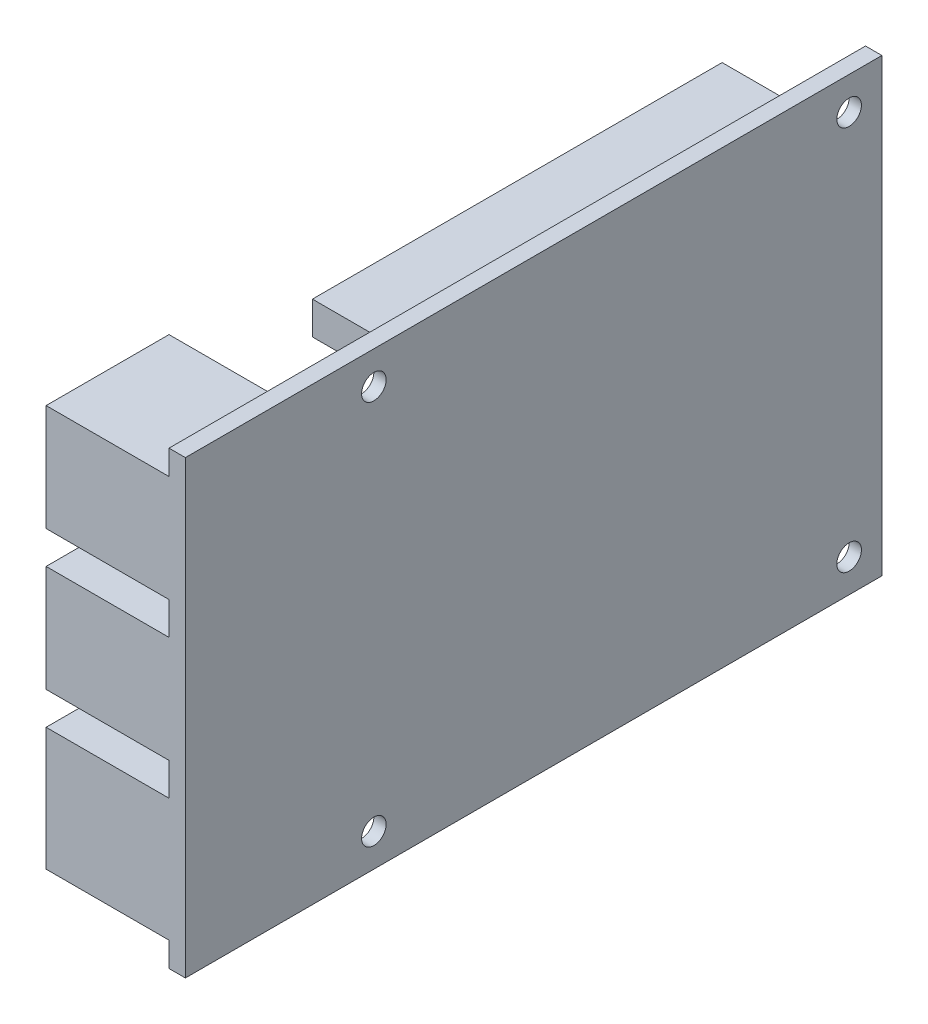
from build123d import *

# Parameters (mm, degrees)
ESQUISSE1_W             = 85
ESQUISSE1_H             = 55
BOSS_EXTRU_1_DEPTH      = 2
ESQUISSE2_W             = 20
ESQUISSE2_H             = 15
ESQUISSE2_W_2           = 15
ESQUISSE2_H_2           = 13
BOSS_EXTRU_2_DEPTH      = 15
ESQUISSE3_R             = 1.5
ENL_V_MAT_EXTRU_1_DEPTH = 15
ESQUISSE5_R             = 2.5
ENL_V_MAT_EXTRU_2_DEPTH = 0.5
ESQUISSE6_W             = 50
ESQUISSE6_H             = 4
BOSS_EXTRU_3_DEPTH      = 9


with BuildPart() as part:
    # Esquisse1 → Boss.-Extru.1 (new body)
    with BuildSketch(Plane(origin=(0, 0, 0), x_dir=(0, 0, -1), z_dir=(1, 0, 0))):
        Rectangle(ESQUISSE1_W, ESQUISSE1_H)
    extrude(amount=BOSS_EXTRU_1_DEPTH)

    # Esquisse2 → Boss.-Extru.2 (add)
    with BuildSketch(Plane.ZY):
        with Locations((32.5, -17)):
            Rectangle(ESQUISSE2_W, ESQUISSE2_H)
        with Locations((35, 1)):
            Rectangle(ESQUISSE2_W_2, ESQUISSE2_H_2)
        with Locations((35, 18)):
            Rectangle(ESQUISSE2_W_2, ESQUISSE2_H_2)
    extrude(amount=BOSS_EXTRU_2_DEPTH)

    # Esquisse3 → Enlèv. mat.-Extru.1 (cut)
    with BuildSketch(Plane.ZY):
        with Locations((-38.5, 23.5)):
            Circle(ESQUISSE3_R)
        with Locations((19.5, 23.5)):
            Circle(ESQUISSE3_R)
        with Locations((-38.5, -23.5)):
            Circle(ESQUISSE3_R)
        with Locations((19.5, -23.5)):
            Circle(ESQUISSE3_R)
    extrude(amount=-ENL_V_MAT_EXTRU_1_DEPTH, mode=Mode.SUBTRACT)

    # Esquisse5 → Enlèv. mat.-Extru.2 (cut)
    with BuildSketch(Plane.ZY):
        with Locations((19.5, 23.5)):
            Circle(ESQUISSE5_R)
        with Locations((-38.5, 23.5)):
            Circle(ESQUISSE5_R)
        with Locations(Location((-38.5, -23.5, 0), (0, 0, 180))):
            Circle(ESQUISSE5_R)
        with Locations(Location((19.5, -23.5, 0), (0, 0, 180))):
            Circle(ESQUISSE5_R)
    extrude(amount=-ENL_V_MAT_EXTRU_2_DEPTH, mode=Mode.SUBTRACT)

    # Esquisse6 → Boss.-Extru.3 (add)
    with BuildSketch(Plane.ZY):
        with Locations((-9, 23.5)):
            Rectangle(ESQUISSE6_W, ESQUISSE6_H)
    extrude(amount=BOSS_EXTRU_3_DEPTH)


solid = part.part
